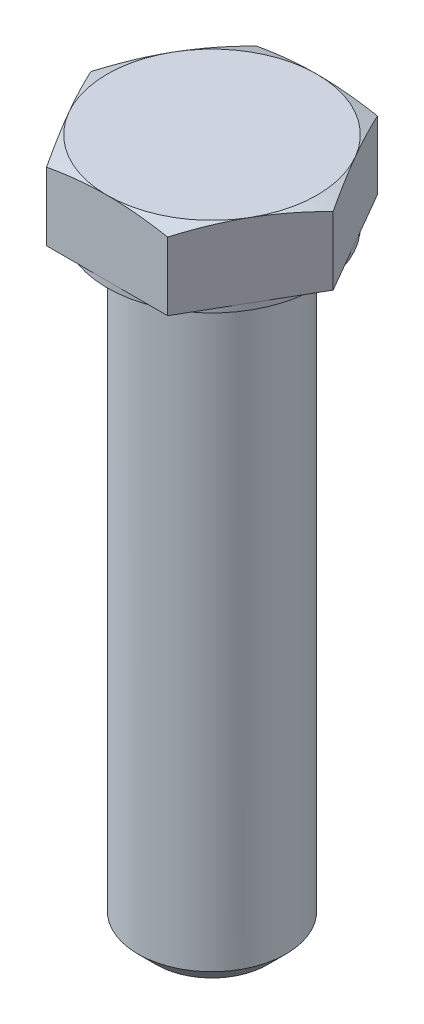
from build123d import *

# Parameters (mm, degrees)
SKETCH1_R           = 12
BOSS_EXTRUDE1_DEPTH = 100
BOSS_EXTRUDE2_DEPTH = 12
SKETCH4_OUTSIDE_W   = 131.89
SKETCH4_OUTSIDE_H   = 126.63
SKETCH4_OUTSIDE_R   = 17
CUT_EXTRUDE1_DEPTH  = 12
CUT_EXTRUDE1_DRAFT  = -70
BOSS_EXTRUDE3_START = 1
SKETCH5_R           = 12
BOSS_EXTRUDE3_DEPTH = 1
CHAMFER1_SIZE       = 3


with BuildPart() as part:
    # Sketch1 → Boss-Extrude1 (new body)
    with BuildSketch(Plane(origin=(0, 0, 0), x_dir=(1, 0, 0), z_dir=(0, 1, 0))):
        with Locations(Location((0, 0, 0), (0, 0, 270))):
            Circle(SKETCH1_R)
    extrude(amount=BOSS_EXTRUDE1_DEPTH)

    # Sketch2 → Boss-Extrude2 (add)
    with BuildSketch(Plane(origin=(0, 100, 0), x_dir=(1, 0, 0), z_dir=(0, 1, 0))):
        Polygon((19.629909152, 0), (9.814954576, 17), (-9.814954576, 17), (-19.629909152, 0), (-9.814954576, -17), (9.814954576, -17), align=None)
    extrude(amount=BOSS_EXTRUDE2_DEPTH)


with BuildPart() as cut_extrude1_tool:
    # Sketch4 outside → Cut-Extrude1 (with draft: the straight prism first)
    with BuildSketch(Plane(origin=(0, 112, 0), x_dir=(1, 0, 0), z_dir=(0, 1, 0))):
        Rectangle(SKETCH4_OUTSIDE_W, SKETCH4_OUTSIDE_H)
        Circle(SKETCH4_OUTSIDE_R, mode=Mode.SUBTRACT)
    extrude(amount=-CUT_EXTRUDE1_DEPTH)
    # Cut-Extrude1: the draft: its side faces are tilted about the plane it starts from
    cut_extrude1_sides = [cut_extrude1_tool.faces().sort_by_distance(p)[0] for p in [
        (0, 106, 63.315),
        (65.945, 106, 0),
        (0, 106, -63.315),
        (-65.945, 106, 0),
        (-17, 106, 0),
    ]]
    draft(cut_extrude1_sides, Plane(origin=(0, 112, 0), x_dir=(1, 0, 0), z_dir=(0, 1, 0)), CUT_EXTRUDE1_DRAFT)


with BuildPart() as part_1:
    add(part.part)

    # Cut-Extrude1: cut by cut_extrude1_tool
    add(cut_extrude1_tool.part, mode=Mode.SUBTRACT)

    # Sketch5 → Boss-Extrude3 (add)
    with BuildSketch(Plane.XZ.offset(-100).offset(BOSS_EXTRUDE3_START)):
        with BuildLine():
            ThreePointArc((16.51491761, -4.032058572), (16.878293743, -2.030566501), (17, 0))
            ThreePointArc((17, 0), (16.420739111, 4.399923526), (14.722432113, 8.499999569))
            ThreePointArc((14.722432113, 8.499999569), (8.500000217, 14.722431739), (3e-09, 17))
            ThreePointArc((3e-09, 17), (-8.500000031, 14.722431846), (-14.722431902, 8.499999935))
            ThreePointArc((-14.722431902, 8.499999935), (-17, -1.47e-07), (-14.722431755, -8.50000019))
            ThreePointArc((-14.722431755, -8.50000019), (-8.499999905, -14.722431919), (0, -17))
            ThreePointArc((0, -17), (8.499999905, -14.722431919), (14.722431755, -8.50000019))
            ThreePointArc((14.722431755, -8.50000019), (15.632314361, -6.680624799), (16.318367478, -4.765593652))
            ThreePointArc((16.318367478, -4.765593652), (16.310925004, -4.370499183), (16.51491761, -4.032058572))
        make_face()
        with Locations(Location((0, 0, 0), (0, 0, 270))):
            Circle(SKETCH5_R, mode=Mode.SUBTRACT)
    extrude(amount=-BOSS_EXTRUDE3_DEPTH)

    # Chamfer1
    chamfer1_edges = [part_1.edges().sort_by_distance(p)[0] for p in [
        (0, 0, -12),
    ]]
    chamfer(chamfer1_edges, length=CHAMFER1_SIZE)


solid = part_1.part
